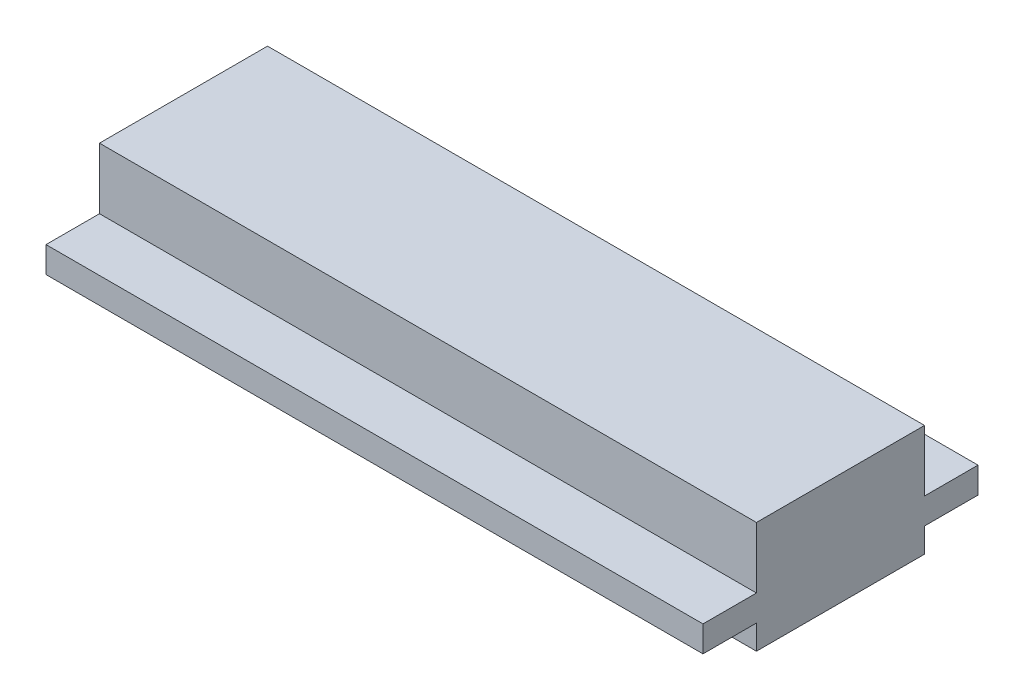
from build123d import *

# Parameters (mm, degrees)
SKETCH1_W           = 43
SKETCH1_H           = 18
BOSS_EXTRUDE1_DEPTH = 1.7
SKETCH2_W           = 43
SKETCH2_H           = 11
BOSS_EXTRUDE2_DEPTH = 4
SKETCH3_W           = 43
SKETCH3_H           = 11
BOSS_EXTRUDE3_DEPTH = 1.6


with BuildPart() as part:
    # Sketch1 → Boss-Extrude1 (new body)
    with BuildSketch(Plane(origin=(0, 0, 0), x_dir=(1, 0, 0), z_dir=(0, 1, 0))):
        with Locations((21.5, 9)):
            Rectangle(SKETCH1_W, SKETCH1_H)
    extrude(amount=BOSS_EXTRUDE1_DEPTH)

    # Sketch2 → Boss-Extrude2 (add)
    with BuildSketch(Plane(origin=(0, 1.7, 0), x_dir=(1, 0, 0), z_dir=(0, 1, 0))):
        with Locations((21.5, 9)):
            Rectangle(SKETCH2_W, SKETCH2_H)
    extrude(amount=BOSS_EXTRUDE2_DEPTH)

    # Sketch3 → Boss-Extrude3 (add)
    with BuildSketch(Plane(origin=(0, 0, 0), x_dir=(-1, 0, 0), z_dir=(0, -1, 0))):
        with Locations((-21.5, 9)):
            Rectangle(SKETCH3_W, SKETCH3_H)
    extrude(amount=BOSS_EXTRUDE3_DEPTH)


solid = part.part
